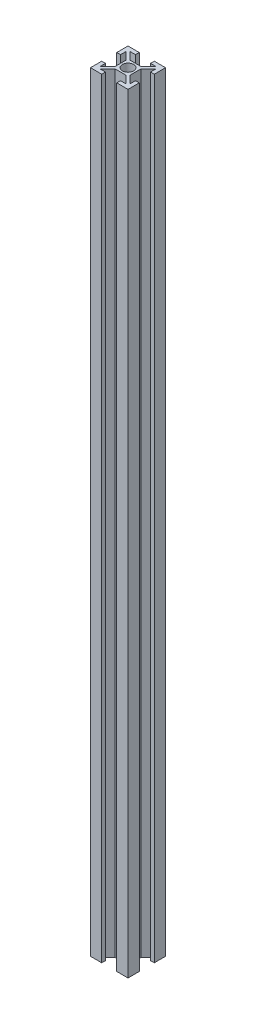
from build123d import *

# Parameters (mm, degrees)
BOSS_EXTRUDE1_START = -12.168666
F_2020_SKETCH_R     = 3
BOSS_EXTRUDE1_DEPTH = 410


with BuildPart() as part:
    # 2020 sketch → Boss-Extrude1 (new body)
    with BuildSketch(Plane(origin=(0, 0, 0), x_dir=(1, 0, 0), z_dir=(0, 1, 0)).offset(BOSS_EXTRUDE1_START)):
        Polygon((-4, 10), (-4, 8), (-7, 8), (-3, 4), (3, 4), (7, 8), (4, 8), (4, 10), (10, 10), (10, 4), (8, 4), (8, 7), (4, 3), (4, -3), (8, -7), (8, -4), (10, -4), (10, -10), (4, -10), (4, -8), (7, -8), (3, -4), (-3, -4), (-7, -8), (-4, -8), (-4, -10), (-10, -10), (-10, -4), (-8, -4), (-8, -7), (-4, -3), (-4, 3), (-8, 7), (-8, 4), (-10, 4), (-10, 10), align=None)
        with Locations(Location((0, 0, 0), (0, 0, 90))):
            Circle(F_2020_SKETCH_R, mode=Mode.SUBTRACT)
    extrude(amount=BOSS_EXTRUDE1_DEPTH)


solid = part.part
